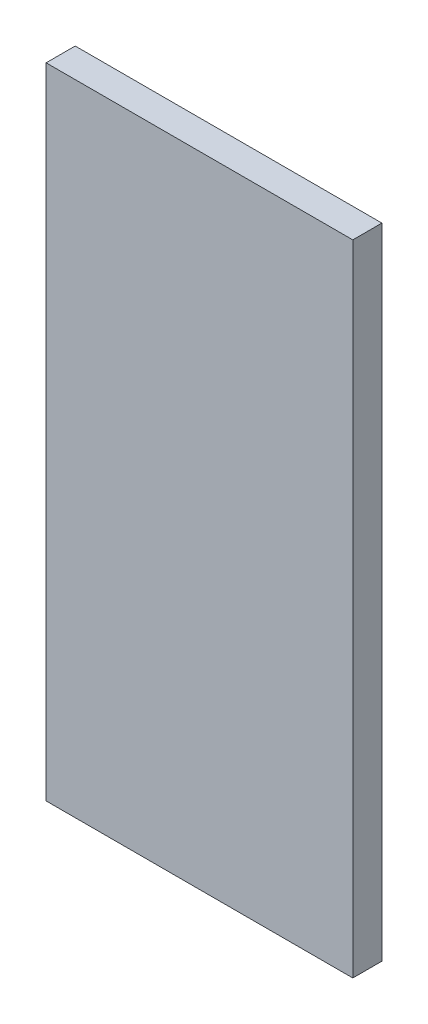
from build123d import *

# Parameters (mm, degrees)
SKIZZE1_W               = 10.541
SKIZZE1_H               = 21.971
COMPONENT_OUTLINE_DEPTH = 1


with BuildPart() as part:
    # Skizze1 → Component_Outline (new body)
    with BuildSketch(Plane.XY):
        with Locations((0, 4.3815)):
            Rectangle(SKIZZE1_W, SKIZZE1_H)
    extrude(amount=COMPONENT_OUTLINE_DEPTH)


solid = part.part
